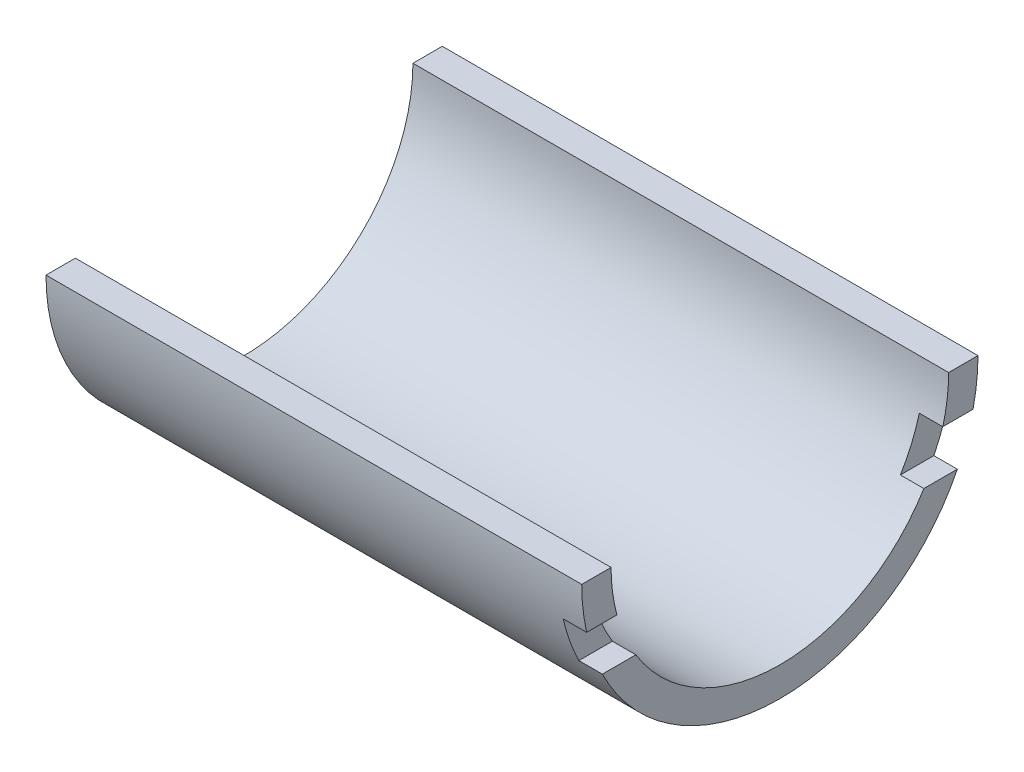
from build123d import *

# Parameters (mm, degrees)
BOSS_EXTRUDE1_DEPTH     = 36.5
CUT_EXTRUDE1_DEPTH      = 53.82281704
CUT_EXTRUDE1_DEPTH_BACK = 3.2
CUT_EXTRUDE1_START      = 36.5
SKETCH2_W               = 57.250046972
SKETCH2_H               = 6


with BuildPart() as part:
    # Sketch1 → Boss-Extrude1 (new, symmetric)
    with BuildSketch(Plane(origin=(0, 0, 0), x_dir=(0, 0, -1), z_dir=(1, 0, 0))):
        with BuildLine():
            Line((-27, 0), (-23, 0))
            ThreePointArc((-23, 0), (0, -23), (23, 0))
            Line((23, 0), (27, 0))
            ThreePointArc((27, 0), (0, -27), (-27, 0))
        make_face()
    extrude(amount=BOSS_EXTRUDE1_DEPTH, both=True)

    # Sketch2 → Cut-Extrude1 (cut, two sides: drawn at the far end of the back side and taken through both)
    with BuildSketch(Plane(origin=(0, 0, 0), x_dir=(0, 0, -1), z_dir=(1, 0, 0)).offset(CUT_EXTRUDE1_START - CUT_EXTRUDE1_DEPTH_BACK)):
        with Locations((-0.586463896, -9)):
            Rectangle(SKETCH2_W, SKETCH2_H)
    extrude(amount=CUT_EXTRUDE1_DEPTH + CUT_EXTRUDE1_DEPTH_BACK, mode=Mode.SUBTRACT)


solid = part.part
